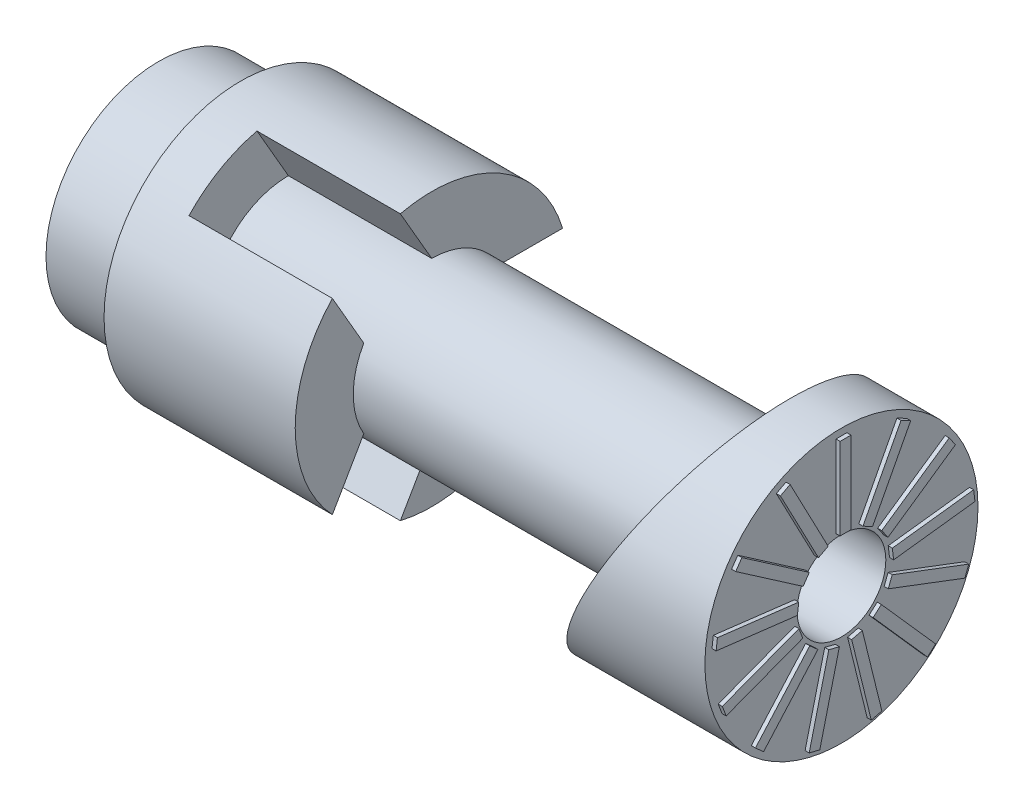
from build123d import *

# Parameters (mm, degrees)
CUT_EXTRUDE_1_DEPTH      = 10.5
CUT_EXTRUDE_2_DEPTH      = 52.961524227
CUT_EXTRUDE_2_DEPTH_BACK = 52.961524227
EXTRUDE_1_REACH          = 40.678
SKETCH_4_R               = 5.75
SKETCH_5_R               = 3.25
CUT_EXTRUDE_3_DEPTH      = 52.961524227
SKETCH_6_W               = 0.8
SKETCH_6_H               = 6
EXTRUDE_2_DEPTH          = 0.3
PATTERN_CIRCULAR_1_COUNT = 13


with BuildPart() as part:
    # 草图1 → 旋转1 (revolve)
    with BuildSketch(Plane.XY):
        Polygon((36, 0), (0, 0), (0, -8.25), (6, -8.25), (6, -10), (20, -10), (20, -5.75), (36, -5.75), align=None)
    revolve(axis=Axis((50, 0, 0), (-1, 0, 0)))

    # 草图2 → 切除-拉伸1 (cut)
    with BuildSketch(Plane(origin=(20, 0, 0), x_dir=(0, 0, -1), z_dir=(1, 0, 0))):
        with BuildLine():
            ThreePointArc((4.979646072, 2.875), (5.75, 0), (4.979646072, -2.875))
            Line((4.979646072, -2.875), (9.577806377, -2.875))
            ThreePointArc((9.577806377, -2.875), (10, 0), (9.577806377, 2.875))
            Line((9.577806377, 2.875), (4.979646072, 2.875))
        make_face()
        with BuildLine():
            ThreePointArc((-4.979646072, 2.875), (-2.875, 4.979646072), (0, 5.75))
            Line((0, 5.75), (-2.299080153, 9.732123635))
            ThreePointArc((-2.299080153, 9.732123635), (-5, 8.660254038), (-7.278726225, 6.857123635))
            Line((-7.278726225, 6.857123635), (-4.979646072, 2.875))
        make_face()
        with BuildLine():
            Line((-2.299080153, -9.732123635), (0, -5.75))
            ThreePointArc((0, -5.75), (-2.875, -4.979646072), (-4.979646072, -2.875))
            Line((-4.979646072, -2.875), (-7.278726225, -6.857123635))
            ThreePointArc((-7.278726225, -6.857123635), (-5, -8.660254038), (-2.299080153, -9.732123635))
        make_face()
    extrude(amount=-CUT_EXTRUDE_1_DEPTH, mode=Mode.SUBTRACT)


with BuildPart() as body_2:
    # 草图1<3> → 旋转2 (revolve)
    with BuildSketch(Plane.XY):
        Polygon((50, 0), (36, 0), (36, -5.75), (36, -10), (50, -10), align=None)
    revolve(axis=Axis((50, 0, 0), (-1, 0, 0)))

    # 草图3 → 切除-拉伸2 (cut, two sides: drawn at the far end of the back side and taken through both)
    with BuildSketch(Plane.XY.offset(-CUT_EXTRUDE_2_DEPTH_BACK)):
        Polygon((36, -10), (36, 10), (46.25, 10), align=None)
    extrude(amount=CUT_EXTRUDE_2_DEPTH + CUT_EXTRUDE_2_DEPTH_BACK, mode=Mode.SUBTRACT)

    # 草图4 → 凸台-拉伸1 (add, up to next)
    with BuildSketch(Plane(origin=(36, 0, 0), x_dir=(0, 0, -1), z_dir=(1, 0, 0)), mode=Mode.PRIVATE) as extrude_1_sk1:
        Circle(SKETCH_4_R)
    extrude_1_tool1 = extrude(extrude_1_sk1.sketch, amount=EXTRUDE_1_REACH, mode=Mode.PRIVATE) - body_2.part

    add(part.part)  # 凸台-拉伸1 merges part
    add(extrude_1_tool1.solids().sort_by_distance((36, 0, 0))[0])

    # 草图5 → 切除-拉伸3 (cut, through all)
    with BuildSketch(Plane(origin=(50, 0, 0), x_dir=(0, 0, -1), z_dir=(1, 0, 0))):
        Circle(SKETCH_5_R)
    extrude(amount=-CUT_EXTRUDE_3_DEPTH, mode=Mode.SUBTRACT)

    # 草图6 → 凸台-拉伸2 (add)
    with BuildSketch(Plane(origin=(50, 0, 0), x_dir=(0, 0, -1), z_dir=(1, 0, 0))):
        with Locations((0, 6.5)):
            Rectangle(SKETCH_6_W, SKETCH_6_H)
    extrude_2 = extrude(amount=EXTRUDE_2_DEPTH)

    # 阵列(圆周)1: 凸台-拉伸2 ×13 about axis
    pattern_circular_1_axis = Axis((0, 0, 0), (1, 0, 0))
    for i in range(1, PATTERN_CIRCULAR_1_COUNT):
        add(extrude_2.rotate(pattern_circular_1_axis, i * 360 / PATTERN_CIRCULAR_1_COUNT))


solid = body_2.part
